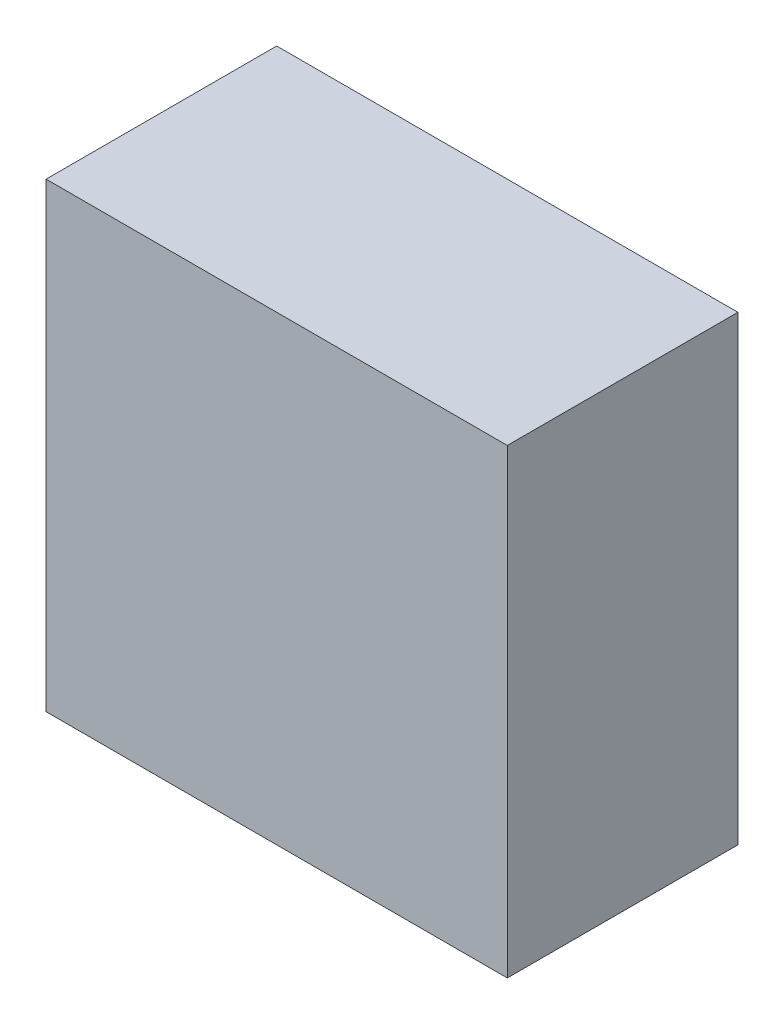
from build123d import *

# Parameters (mm, degrees)
ESQUISSE1_W             = 2
ESQUISSE1_H             = 2
COMPONENT_OUTLINE_DEPTH = 1


with BuildPart() as part:
    # Esquisse1 → Component_Outline (new body)
    with BuildSketch(Plane.XY):
        Rectangle(ESQUISSE1_W, ESQUISSE1_H)
    extrude(amount=COMPONENT_OUTLINE_DEPTH)


solid = part.part
